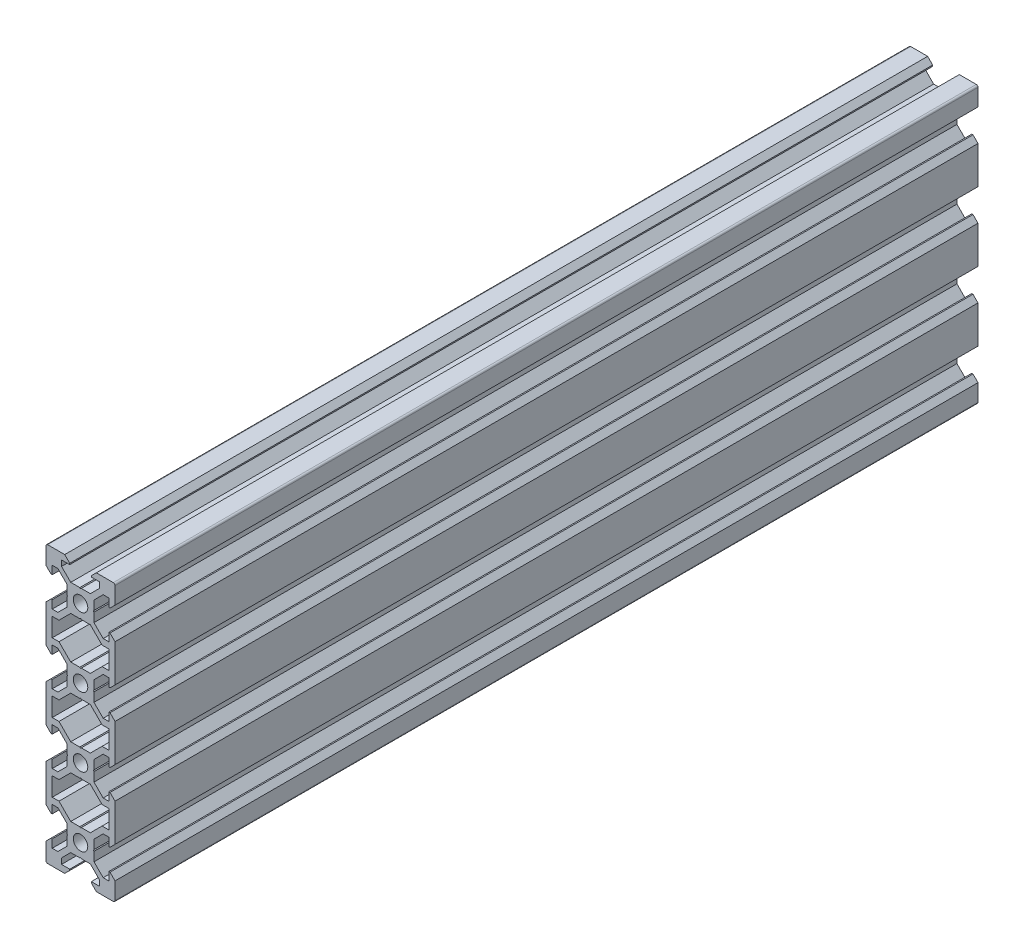
from build123d import *

# Parameters (mm, degrees)
BOSS_EXTRU_1_DEPTH = 250


with BuildPart() as part:
    # Esquisse1 → Boss.-Extru.1 (new body)
    with BuildSketch(Plane.XY):
        with BuildLine():
            Line((-9.5, 10), (-4.58, 10))
            Line((-4.58, 10), (-3.125, 8.545))
            Line((-3.125, 8.545), (-3.125, 8.2))
            Line((-3.125, 8.2), (-5.5, 8.2))
            Line((-5.5, 8.2), (-5.5, 6.560660172))
            Line((-5.5, 6.560660172), (-2.839339828, 3.9))
            Line((-2.839339828, 3.9), (-0.21, 3.9))
            Line((-0.21, 3.9), (0, 3.69))
            Line((0, 3.69), (0, 2.1))
            ThreePointArc((0, 2.1), (-2.1, 0), (0, -2.1))
            Line((0, -2.1), (0, -3.69))
            Line((0, -3.69), (-0.21, -3.9))
            Line((-0.21, -3.9), (-2.839339828, -3.9))
            Line((-2.839339828, -3.9), (-6.239339828, -7.3))
            Line((-6.239339828, -7.3), (-8.2, -7.3))
            Line((-8.2, -7.3), (-8.2, -12.7))
            Line((-8.2, -12.7), (-6.239339828, -12.7))
            Line((-6.239339828, -12.7), (-2.839339828, -16.1))
            Line((-2.839339828, -16.1), (-0.21, -16.1))
            Line((-0.21, -16.1), (0, -16.31))
            Line((0, -16.31), (0, -17.9))
            ThreePointArc((0, -17.9), (-2.1, -20), (0, -22.1))
            Line((0, -22.1), (0, -23.69))
            Line((0, -23.69), (-0.21, -23.9))
            Line((-0.21, -23.9), (-2.839339828, -23.9))
            Line((-2.839339828, -23.9), (-6.239339828, -27.3))
            Line((-6.239339828, -27.3), (-8.2, -27.3))
            Line((-8.2, -27.3), (-8.2, -32.7))
            Line((-8.2, -32.7), (-6.239339828, -32.7))
            Line((-6.239339828, -32.7), (-2.839339828, -36.1))
            Line((-2.839339828, -36.1), (-0.21, -36.1))
            Line((-0.21, -36.1), (0, -36.31))
            Line((0, -36.31), (0, -37.9))
            ThreePointArc((0, -37.9), (-2.1, -40), (0, -42.1))
            Line((0, -42.1), (0, -43.69))
            Line((0, -43.69), (-0.21, -43.9))
            Line((-0.21, -43.9), (-2.839339828, -43.9))
            Line((-2.839339828, -43.9), (-6.239339828, -47.3))
            Line((-6.239339828, -47.3), (-8.2, -47.3))
            Line((-8.2, -47.3), (-8.2, -52.7))
            Line((-8.2, -52.7), (-6.239339828, -52.7))
            Line((-6.239339828, -52.7), (-2.839339828, -56.1))
            Line((-2.839339828, -56.1), (-0.21, -56.1))
            Line((-0.21, -56.1), (0, -56.31))
            Line((0, -56.31), (0, -57.9))
            ThreePointArc((0, -57.9), (-2.1, -60), (0, -62.1))
            Line((0, -62.1), (0, -63.69))
            Line((0, -63.69), (-0.21, -63.9))
            Line((-0.21, -63.9), (-2.839339828, -63.9))
            Line((-2.839339828, -63.9), (-5.5, -66.560660172))
            Line((-5.5, -66.560660172), (-5.5, -68.2))
            Line((-5.5, -68.2), (-3.125, -68.2))
            Line((-3.125, -68.2), (-3.125, -68.545))
            Line((-3.125, -68.545), (-4.58, -70))
            Line((-4.58, -70), (-9.5, -70))
            ThreePointArc((-9.5, -70), (-9.853553391, -69.853553391), (-10, -69.5))
            Line((-10, -69.5), (-10, -64.58))
            Line((-10, -64.58), (-8.545, -63.125))
            Line((-8.545, -63.125), (-8.2, -63.125))
            Line((-8.2, -63.125), (-8.2, -65.5))
            Line((-8.2, -65.5), (-6.560660172, -65.5))
            Line((-6.560660172, -65.5), (-3.9, -62.839339828))
            Line((-3.9, -62.839339828), (-3.9, -60.21))
            Line((-3.9, -60.21), (-3.69, -60))
            Line((-3.69, -60), (-3.9, -59.79))
            Line((-3.9, -59.79), (-3.9, -57.160660172))
            Line((-3.9, -57.160660172), (-6.560660172, -54.5))
            Line((-6.560660172, -54.5), (-8.2, -54.5))
            Line((-8.2, -54.5), (-8.2, -56.875))
            Line((-8.2, -56.875), (-8.545, -56.875))
            Line((-8.545, -56.875), (-10, -55.42))
            Line((-10, -55.42), (-10, -44.58))
            Line((-10, -44.58), (-8.545, -43.125))
            Line((-8.545, -43.125), (-8.2, -43.125))
            Line((-8.2, -43.125), (-8.2, -45.5))
            Line((-8.2, -45.5), (-6.560660172, -45.5))
            Line((-6.560660172, -45.5), (-3.9, -42.839339828))
            Line((-3.9, -42.839339828), (-3.9, -40.21))
            Line((-3.9, -40.21), (-3.69, -40))
            Line((-3.69, -40), (-3.9, -39.79))
            Line((-3.9, -39.79), (-3.9, -37.160660172))
            Line((-3.9, -37.160660172), (-6.560660172, -34.5))
            Line((-6.560660172, -34.5), (-8.2, -34.5))
            Line((-8.2, -34.5), (-8.2, -36.875))
            Line((-8.2, -36.875), (-8.545, -36.875))
            Line((-8.545, -36.875), (-10, -35.42))
            Line((-10, -35.42), (-10, -24.58))
            Line((-10, -24.58), (-8.545, -23.125))
            Line((-8.545, -23.125), (-8.2, -23.125))
            Line((-8.2, -23.125), (-8.2, -25.5))
            Line((-8.2, -25.5), (-6.560660172, -25.5))
            Line((-6.560660172, -25.5), (-3.9, -22.839339828))
            Line((-3.9, -22.839339828), (-3.9, -20.21))
            Line((-3.9, -20.21), (-3.69, -20))
            Line((-3.69, -20), (-3.9, -19.79))
            Line((-3.9, -19.79), (-3.9, -17.160660172))
            Line((-3.9, -17.160660172), (-6.560660172, -14.5))
            Line((-6.560660172, -14.5), (-8.2, -14.5))
            Line((-8.2, -14.5), (-8.2, -16.875))
            Line((-8.2, -16.875), (-8.545, -16.875))
            Line((-8.545, -16.875), (-10, -15.42))
            Line((-10, -15.42), (-10, -4.58))
            Line((-10, -4.58), (-8.545, -3.125))
            Line((-8.545, -3.125), (-8.2, -3.125))
            Line((-8.2, -3.125), (-8.2, -5.5))
            Line((-8.2, -5.5), (-6.560660172, -5.5))
            Line((-6.560660172, -5.5), (-3.9, -2.839339828))
            Line((-3.9, -2.839339828), (-3.9, -0.21))
            Line((-3.9, -0.21), (-3.69, 0))
            Line((-3.69, 0), (-3.9, 0.21))
            Line((-3.9, 0.21), (-3.9, 2.839339828))
            Line((-3.9, 2.839339828), (-6.560660172, 5.5))
            Line((-6.560660172, 5.5), (-8.2, 5.5))
            Line((-8.2, 5.5), (-8.2, 3.125))
            Line((-8.2, 3.125), (-8.545, 3.125))
            Line((-8.545, 3.125), (-10, 4.58))
            Line((-10, 4.58), (-10, 9.5))
            ThreePointArc((-10, 9.5), (-9.853553391, 9.853553391), (-9.5, 10))
        make_face()
    boss_extru_1 = extrude(amount=BOSS_EXTRU_1_DEPTH)

    # Symétrie1: Boss.-Extru.1 across plane
    add(boss_extru_1.mirror(Plane(origin=(0, 3.69, 250), x_dir=(0, 0, 1), z_dir=(-1, 0, 0))))


solid = part.part
